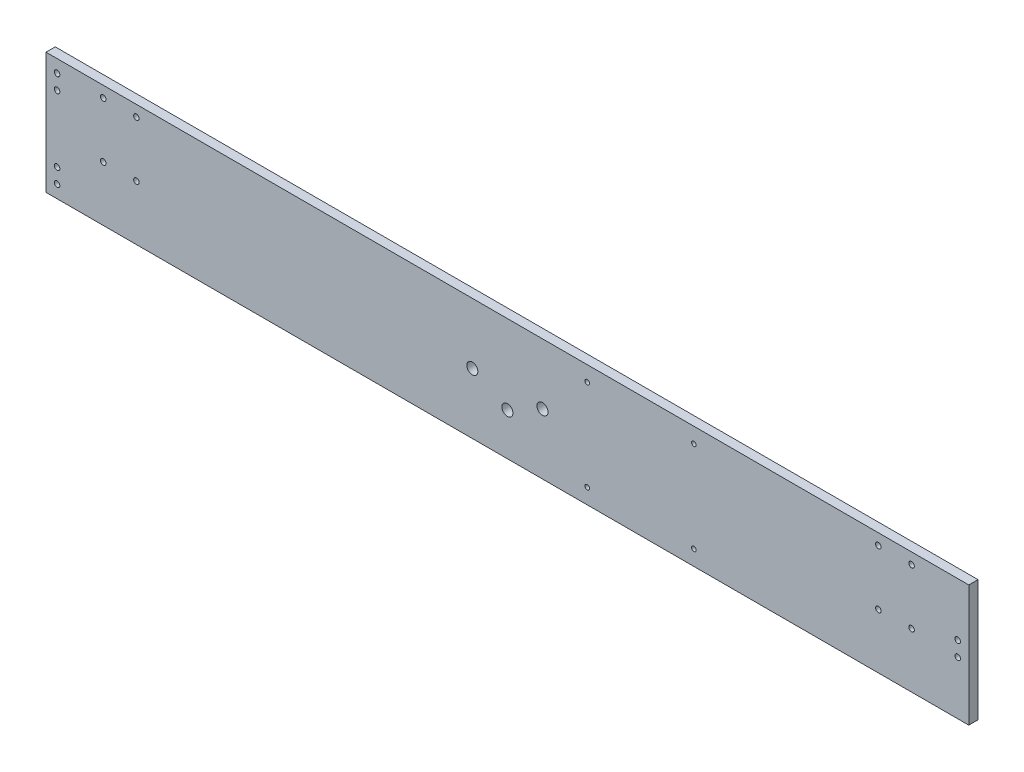
from build123d import *

# Parameters (mm, degrees)
SKETCH_3_W          = 500
SKETCH_3_H          = 65.8
SKETCH_3_R          = 1.25
EXTRUDE_2_DEPTH     = 5
SKETCH_4_R          = 1.5
CUT_EXTRUDE_1_DEPTH = 5
SKETCH_5_R          = 1.5
CUT_EXTRUDE_2_DEPTH = 5
SKETCH_6_R          = 3
CUT_EXTRUDE_3_DEPTH = 10


with BuildPart() as part:
    # 草图3 → 凸台-拉伸2 (new body)
    with BuildSketch(Plane.XY):
        Rectangle(SKETCH_3_W, SKETCH_3_H)
        with Locations((43.25, 24.65)):
            Circle(SKETCH_3_R, mode=Mode.SUBTRACT)
        with Locations((43.25, -24.65)):
            Circle(SKETCH_3_R, mode=Mode.SUBTRACT)
        with Locations((101.05, -24.65)):
            Circle(SKETCH_3_R, mode=Mode.SUBTRACT)
        with Locations((101.05, 24.65)):
            Circle(SKETCH_3_R, mode=Mode.SUBTRACT)
    extrude(amount=EXTRUDE_2_DEPTH)

    # 草图4 → 切除-拉伸1 (cut)
    with BuildSketch(Plane.XY.offset(5)):
        with Locations((219, 26.9)):
            Circle(SKETCH_4_R)
        with Locations((219, -3.1)):
            Circle(SKETCH_4_R)
        with Locations((-219, -3.1)):
            Circle(SKETCH_4_R)
        with Locations((-219, 26.9)):
            Circle(SKETCH_4_R)
        with Locations((201, -3.1)):
            Circle(SKETCH_4_R)
        with Locations((201, 26.9)):
            Circle(SKETCH_4_R)
        with Locations((-201, -3.1)):
            Circle(SKETCH_4_R)
        with Locations((-201, 26.9)):
            Circle(SKETCH_4_R)
    extrude(amount=-CUT_EXTRUDE_1_DEPTH, mode=Mode.SUBTRACT)

    # 草图5 → 切除-拉伸2 (cut)
    with BuildSketch(Plane.XY.offset(5)):
        with Locations((-244, 26)):
            Circle(SKETCH_5_R)
        with Locations((-244, 18)):
            Circle(SKETCH_5_R)
        with Locations((-244, -18)):
            Circle(SKETCH_5_R)
        with Locations((-244, -26)):
            Circle(SKETCH_5_R)
        with Locations((244, -4)):
            Circle(SKETCH_5_R)
        with Locations((244, 4)):
            Circle(SKETCH_5_R)
    extrude(amount=-CUT_EXTRUDE_2_DEPTH, mode=Mode.SUBTRACT)

    # 草图6 → 切除-拉伸3 (cut)
    with BuildSketch(Plane.XY.offset(5)):
        with Locations((19, 0)):
            Circle(SKETCH_6_R)
        with Locations((-19, 0)):
            Circle(SKETCH_6_R)
        with Locations((0, -10)):
            Circle(SKETCH_6_R)
    extrude(amount=-CUT_EXTRUDE_3_DEPTH, mode=Mode.SUBTRACT)


solid = part.part
